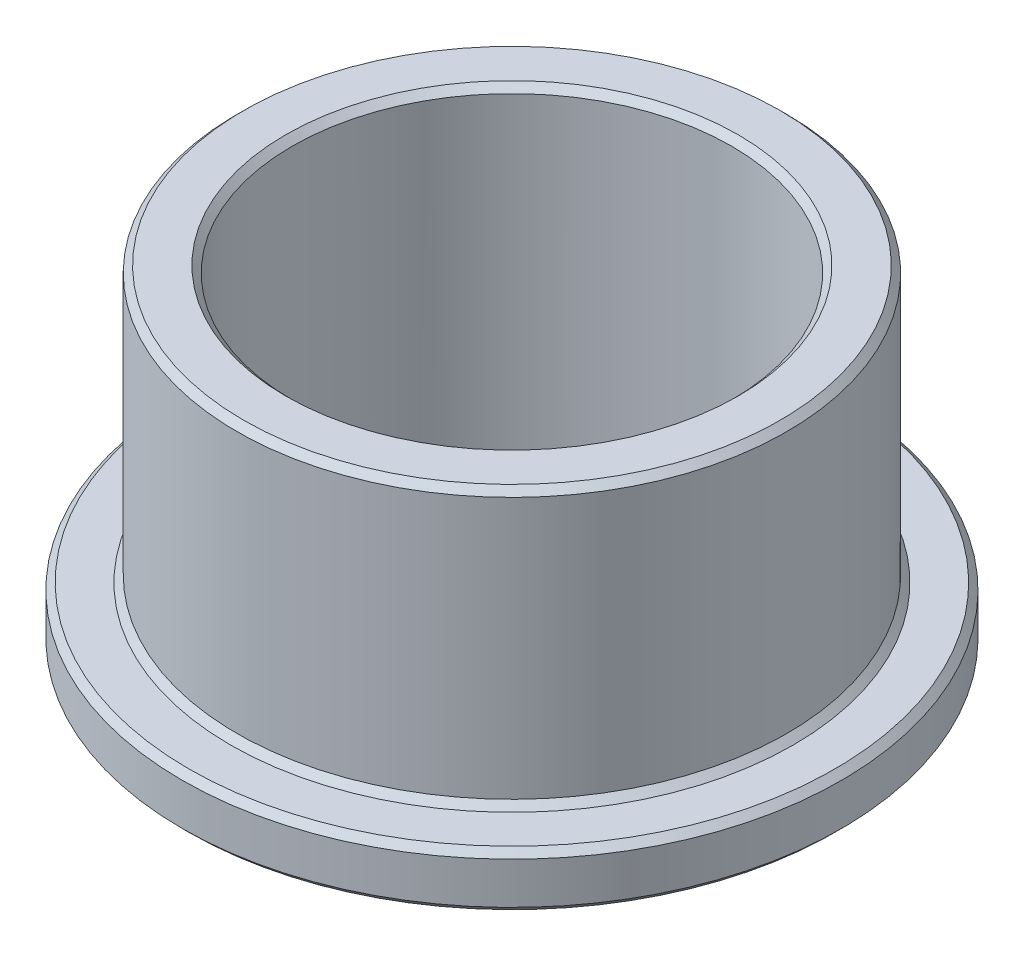
from build123d import *

# Parameters (mm, degrees)
SKETCH1_R           = 19.05
SKETCH1_R_2         = 15.8877
BOSS_EXTRUDE1_DEPTH = 3.175
SKETCH1_3_R         = 15.8877
SKETCH1_3_R_2       = 12.7
BOSS_EXTRUDE2_DEPTH = 19.05
CHAMFER1_SIZE       = 0.381


with BuildPart() as part:
    # Sketch1 → Boss-Extrude1 (new body)
    with BuildSketch(Plane(origin=(0, 0, 0), x_dir=(1, 0, 0), z_dir=(0, 1, 0))):
        with Locations((-30.385488136, 94.907759241)):
            Circle(SKETCH1_R)
        with Locations((-30.385488136, 94.907759241)):
            Circle(SKETCH1_R_2, mode=Mode.SUBTRACT)
    extrude(amount=BOSS_EXTRUDE1_DEPTH)

    # Sketch1<3> → Boss-Extrude2 (add)
    with BuildSketch(Plane(origin=(0, 0, 0), x_dir=(1, 0, 0), z_dir=(0, 1, 0))):
        with Locations((-30.385488136, 94.907759241)):
            Circle(SKETCH1_3_R)
        with Locations((-30.385488136, 94.907759241)):
            Circle(SKETCH1_3_R_2, mode=Mode.SUBTRACT)
    extrude(amount=BOSS_EXTRUDE2_DEPTH)

    # Chamfer1
    chamfer1_edges = [part.edges().sort_by_distance(p)[0] for p in [
        (-43.085488136, 0, -94.907759241),
        (-49.435488136, 0, -94.907759241),
        (-49.435488136, 3.175, -94.907759241),
        (-46.273188136, 3.175, -94.907759241),
        (-43.085488136, 19.05, -94.907759241),
        (-46.273188136, 19.05, -94.907759241),
    ]]
    chamfer(chamfer1_edges, length=CHAMFER1_SIZE)


solid = part.part
